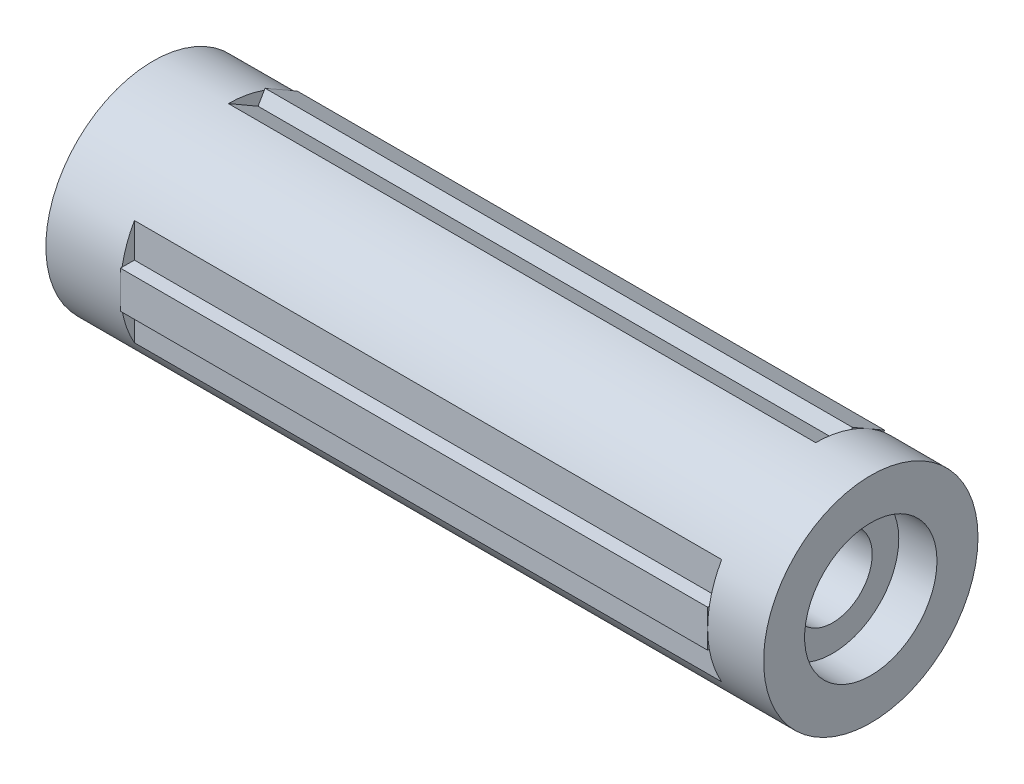
from build123d import *

# Parameters (mm, degrees)
SKIZZE1_R                       = 11.5
AUFSATZ_LINEAR_AUSTRAGEN1_DEPTH = 77
SKIZZE2_R                       = 7.1
SCHNITT_LINEAR_AUSTRAGEN1_DEPTH = 4.1
SKIZZE3_R                       = 4.25
SCHNITT_LINEAR_AUSTRAGEN2_DEPTH = 11
SKIZZE4_R                       = 9.6
SCHNITT_LINEAR_AUSTRAGEN3_DEPTH = 11.8
SCHNITT_LINEAR_START            = -6
SKIZZE7_W                       = 1.5
SKIZZE7_H                       = 15
SCHNITT_LINEAR_AUSTRAGEN4_DEPTH = 63
SKIZZE8_W                       = 63
SKIZZE8_H                       = 4
AUFSATZ_LINEAR_AUSTRAGEN2_DEPTH = 1.5
SCHNITT_LINEAR_AUSTRAGEN6_DEPTH = 13.5
SKIZZE12_R                      = 3
SCHNITT_LINEAR_AUSTRAGEN7_DEPTH = 2
KREISMUSTER3_COUNT              = 3


with BuildPart() as part:
    # Skizze1 → Aufsatz-Linear austragen1 (new body)
    with BuildSketch(Plane(origin=(0, 0, 0), x_dir=(0, 0, -1), z_dir=(1, 0, 0))):
        Circle(SKIZZE1_R)
    extrude(amount=AUFSATZ_LINEAR_AUSTRAGEN1_DEPTH)

    # Skizze2 → Schnitt-Linear austragen1 (cut)
    with BuildSketch(Plane(origin=(77, 0, 0), x_dir=(0, 0, -1), z_dir=(1, 0, 0))):
        Circle(SKIZZE2_R)
    extrude(amount=-SCHNITT_LINEAR_AUSTRAGEN1_DEPTH, mode=Mode.SUBTRACT)

    # Skizze3 → Schnitt-Linear austragen2 (cut)
    with BuildSketch(Plane(origin=(72.9, 0, 0), x_dir=(0, 0, -1), z_dir=(1, 0, 0))):
        Circle(SKIZZE3_R)
    extrude(amount=-SCHNITT_LINEAR_AUSTRAGEN2_DEPTH, mode=Mode.SUBTRACT)

    # Skizze4 → Schnitt-Linear austragen3 (cut)
    with BuildSketch(Plane.ZY):
        Circle(SKIZZE4_R)
    extrude(amount=-SCHNITT_LINEAR_AUSTRAGEN3_DEPTH, mode=Mode.SUBTRACT)

    # Skizze7 → Schnitt-Linear austragen4 (cut)
    with BuildSketch(Plane(origin=(77, 0, 0), x_dir=(0, 0, -1), z_dir=(1, 0, 0)).offset(SCHNITT_LINEAR_START)):
        with Locations((-10.75, 0)):
            Rectangle(SKIZZE7_W, SKIZZE7_H)
    schnitt_linear_austragen4 = extrude(amount=-SCHNITT_LINEAR_AUSTRAGEN4_DEPTH, mode=Mode.SUBTRACT)

    # Skizze8 → Aufsatz-Linear austragen2 (add)
    with BuildSketch(Plane.XY.offset(10)):
        with Locations((39.5, 0)):
            Rectangle(SKIZZE8_W, SKIZZE8_H)
    aufsatz_linear_austragen2 = extrude(amount=AUFSATZ_LINEAR_AUSTRAGEN2_DEPTH)

    # Skizze10 → Schnitt-Linear austragen6 (cut)
    with BuildSketch(Plane.ZY.offset(-11.8)):
        Polygon((4.038863706, -2.240739453), (3.959969143, 2.377388845), (-0.078894563, 4.618128298), (-4.038863706, 2.240739453), (-3.959969143, -2.377388845), (0.078894563, -4.618128298), align=None)
    extrude(amount=-SCHNITT_LINEAR_AUSTRAGEN6_DEPTH, mode=Mode.SUBTRACT)

    # Skizze12 → Schnitt-Linear austragen7 (cut)
    with BuildSketch(Plane.ZY.offset(-25.3)):
        Circle(SKIZZE12_R)
    extrude(amount=-SCHNITT_LINEAR_AUSTRAGEN7_DEPTH, mode=Mode.SUBTRACT)

    # Kreismuster3: Schnitt-Linear austragen4, Aufsatz-Linear austragen2 ×3 about axis
    kreismuster3_axis = Axis((0, 0, 0), (1, 0, 0))
    add([schnitt_linear_austragen4.rotate(kreismuster3_axis, i * 360 / KREISMUSTER3_COUNT) for i in range(1, KREISMUSTER3_COUNT)], mode=Mode.SUBTRACT)
    add([aufsatz_linear_austragen2.rotate(kreismuster3_axis, i * 360 / KREISMUSTER3_COUNT) for i in range(1, KREISMUSTER3_COUNT)])


solid = part.part
